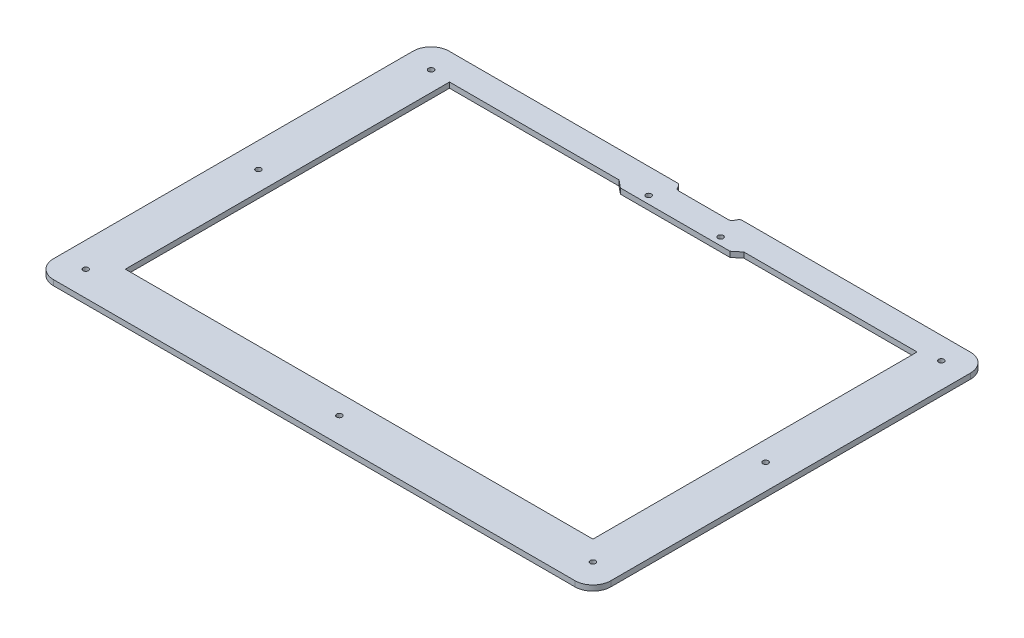
from build123d import *

# Parameters (mm, degrees)
SKETCH_1_R      = 1.5
EXTRUDE_1_DEPTH = 3


with BuildPart() as part:
    # 草图1 → 凸台-拉伸1 (new body)
    with BuildSketch(Plane(origin=(0, 0, 0), x_dir=(1, 0, 0), z_dir=(0, 1, 0))):
        with BuildLine():
            Line((10, 0), (136.884360712, 0))
            ThreePointArc((136.884360712, 0), (137.900113715, -0.277140216), (138.634360712, -1.031754163))
            Line((138.634360712, -1.031754163), (139.429147615, -2.468245837))
            ThreePointArc((139.429147615, -2.468245837), (140.163394612, -3.222859784), (141.179147615, -3.5))
            Line((141.179147615, -3.5), (168.820852385, -3.5))
            ThreePointArc((168.820852385, -3.5), (169.836605388, -3.222859784), (170.570852385, -2.468245837))
            Line((170.570852385, -2.468245837), (171.365639288, -1.031754163))
            ThreePointArc((171.365639288, -1.031754163), (172.099886285, -0.277140216), (173.115639288, 0))
            Line((173.115639288, 0), (300, 0))
            ThreePointArc((300, 0), (307.071067812, -2.928932188), (310, -10))
            Line((310, -10), (310, -210))
            ThreePointArc((310, -210), (307.071067812, -217.071067812), (300, -220))
            Line((300, -220), (10, -220))
            ThreePointArc((10, -220), (2.928932188, -217.071067812), (0, -210))
            Line((0, -210), (0, -10))
            ThreePointArc((0, -10), (2.928932188, -2.928932188), (10, 0))
        make_face()
        with Locations(Location((14, -14, 0), (0, 0, 270))):
            Circle(SKETCH_1_R, mode=Mode.SUBTRACT)
        with Locations(Location((14, -206, 0), (0, 0, 270))):
            Circle(SKETCH_1_R, mode=Mode.SUBTRACT)
        with Locations(Location((296, -206, 0), (0, 0, 270))):
            Circle(SKETCH_1_R, mode=Mode.SUBTRACT)
        with Locations(Location((296, -12.28568254, 0), (0, 0, 270))):
            Circle(SKETCH_1_R, mode=Mode.SUBTRACT)
        with Locations(Location((155, -206, 0), (0, 0, 270))):
            Circle(SKETCH_1_R, mode=Mode.SUBTRACT)
        with Locations(Location((175, -14, 0), (0, 0, 270))):
            Circle(SKETCH_1_R, mode=Mode.SUBTRACT)
        with Locations(Location((135, -14, 0), (0, 0, 270))):
            Circle(SKETCH_1_R, mode=Mode.SUBTRACT)
        with Locations(Location((296, -110, 0), (0, 0, 270))):
            Circle(SKETCH_1_R, mode=Mode.SUBTRACT)
        with Locations(Location((14, -110, 0), (0, 0, 270))):
            Circle(SKETCH_1_R, mode=Mode.SUBTRACT)
        Polygon((184.455213096, -18.25), (188.75, -14.75), (285, -14.75), (285, -195), (25, -195), (25, -14.75), (119.25, -14.75), (123.544786904, -18.25), (141.179147615, -18.25), (168.820852385, -18.25), align=None, mode=Mode.SUBTRACT)
    extrude(amount=EXTRUDE_1_DEPTH)


solid = part.part
